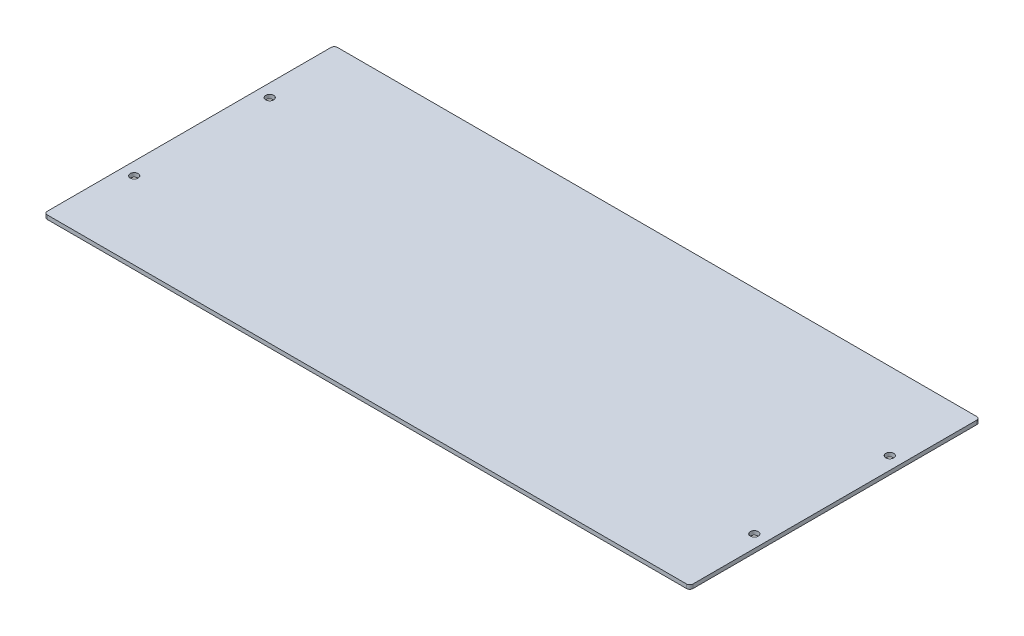
from build123d import *

# Parameters (mm, degrees)
SKETCH1_W                   = 514.35
SKETCH1_H                   = 231.14
BOSS_EXTRUDE1_DEPTH         = 3.175
F_1_4_0_25_DIAMETER_HOLE1_D = 6.35
FILLET1_R                   = 2.54


with BuildPart() as part:
    # Sketch1 → Boss-Extrude1 (new body)
    with BuildSketch(Plane(origin=(0, 0, 0), x_dir=(1, 0, 0), z_dir=(0, 1, 0))):
        Rectangle(SKETCH1_W, SKETCH1_H)
    extrude(amount=BOSS_EXTRUDE1_DEPTH)

    # 1/4 (0.25) Diameter Hole1 (through all)
    with Locations(Plane(origin=(0, 3.175, 0), x_dir=(1, 0, 0), z_dir=(0, 1, 0))):
        with Locations((-247.015, 53.975), (-247.015, -53.975), (247.015, -53.975), (247.015, 53.975)):
            Hole(F_1_4_0_25_DIAMETER_HOLE1_D / 2)

    # Fillet1
    fillet1_edges = [part.edges().sort_by_distance(p)[0] for p in [
        (257.175, 1.5875, 115.57),
        (-257.175, 1.5875, 115.57),
        (-257.175, 1.5875, -115.57),
        (257.175, 1.5875, -115.57),
    ]]
    fillet(fillet1_edges, radius=FILLET1_R)


solid = part.part
